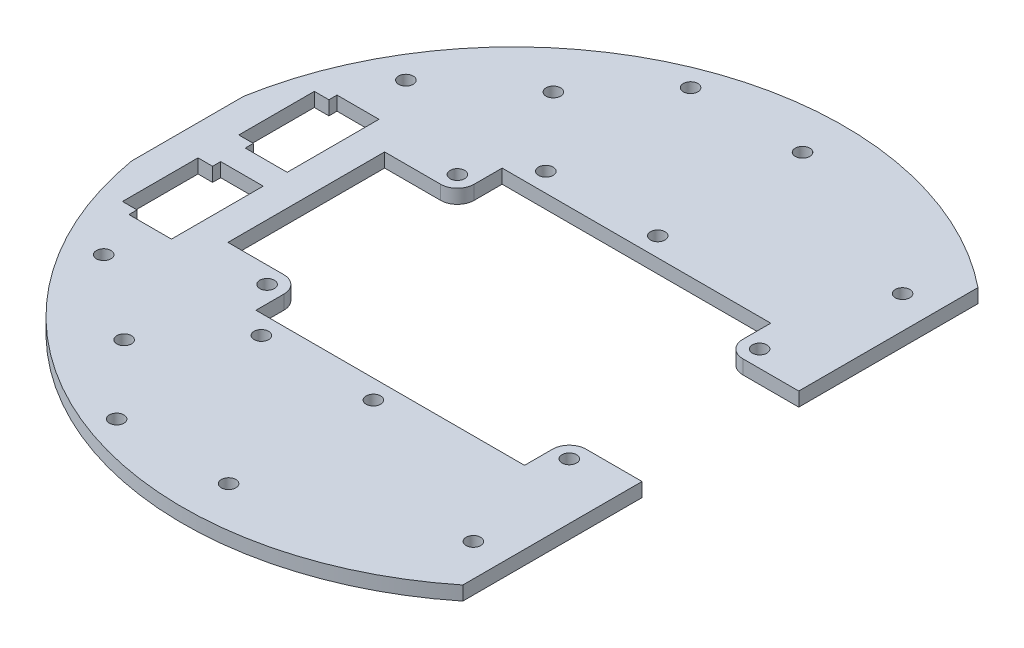
from build123d import *

# Parameters (mm, degrees)
SKETCH1_R           = 1.651
BOSS_EXTRUDE1_DEPTH = 3.175
CUT_EXTRUDE1_START  = -3.175
CUT_EXTRUDE1_DEPTH  = 3.175


with BuildPart() as part:
    # Sketch1 → Boss-Extrude1 (new body)
    with BuildSketch(Plane(origin=(0, 0, 0), x_dir=(1, 0, 0), z_dir=(0, 1, 0))):
        with BuildLine():
            Line((-73.916912814, 12.7), (-73.916912814, -12.7))
            ThreePointArc((-73.916912814, -12.7), (75, 0), (-73.916912814, 12.7))
        make_face()
        with Locations(Location((-34.29, 21.59, 0), (0, 0, 270))):
            Circle(SKETCH1_R, mode=Mode.SUBTRACT)
        with Locations(Location((34.29, 21.59, 0), (0, 0, 270))):
            Circle(SKETCH1_R, mode=Mode.SUBTRACT)
        with Locations(Location((-34.29, -21.59, 0), (0, 0, 270))):
            Circle(SKETCH1_R, mode=Mode.SUBTRACT)
        with Locations(Location((34.29, -21.59, 0), (0, 0, 270))):
            Circle(SKETCH1_R, mode=Mode.SUBTRACT)
        with Locations(Location((39.626912814, -48.698461806, 0), (0, 0, 270))):
            Circle(SKETCH1_R, mode=Mode.SUBTRACT)
        with Locations(Location((-58.676912814, -34.29, 0), (0, 0, 270))):
            Circle(SKETCH1_R, mode=Mode.SUBTRACT)
        with Locations(Location((-58.676912814, 34.29, 0), (0, 0, 270))):
            Circle(SKETCH1_R, mode=Mode.SUBTRACT)
        with Locations(Location((39.626912814, 48.698461806, 0), (0, 0, 270))):
            Circle(SKETCH1_R, mode=Mode.SUBTRACT)
        with Locations(Location((0.498087186, -65.123461806, 0), (0, 0, 90))):
            Circle(SKETCH1_R, mode=Mode.SUBTRACT)
        with Locations(Location((0.498087186, -32.273461806, 0), (0, 0, 90))):
            Circle(SKETCH1_R, mode=Mode.SUBTRACT)
        with Locations(Location((0.498087186, 32.273461806, 0), (0, 0, 270))):
            Circle(SKETCH1_R, mode=Mode.SUBTRACT)
        with Locations(Location((0.498087186, 65.123461806, 0), (0, 0, 270))):
            Circle(SKETCH1_R, mode=Mode.SUBTRACT)
        with Locations(Location((-39.626912814, -48.698461806, 0), (0, 0, 270))):
            Circle(SKETCH1_R, mode=Mode.SUBTRACT)
        with Locations(Location((-24.901912814, -32.273461806, 0), (0, 0, 270))):
            Circle(SKETCH1_R, mode=Mode.SUBTRACT)
        with Locations(Location((-24.901912814, -65.123461806, 0), (0, 0, 270))):
            Circle(SKETCH1_R, mode=Mode.SUBTRACT)
        with Locations(Location((-24.901912814, 65.123461806, 0), (0, 0, 90))):
            Circle(SKETCH1_R, mode=Mode.SUBTRACT)
        with Locations(Location((-39.626912814, 48.698461806, 0), (0, 0, 90))):
            Circle(SKETCH1_R, mode=Mode.SUBTRACT)
        with Locations(Location((-24.901912814, 32.273461806, 0), (0, 0, 90))):
            Circle(SKETCH1_R, mode=Mode.SUBTRACT)
        with BuildLine():
            Line((-30.48, 27.94), (30.48, 27.94))
            Line((30.48, 27.94), (30.48, 21.59))
            ThreePointArc((30.48, 21.59), (31.595923164, 18.895923164), (34.29, 17.78))
            Line((34.29, 17.78), (46.99, 17.78))
            Line((46.99, 17.78), (46.99, -17.78))
            Line((46.99, -17.78), (34.29, -17.78))
            ThreePointArc((34.29, -17.78), (31.595923164, -18.895923164), (30.48, -21.59))
            Line((30.48, -21.59), (30.48, -27.94))
            Line((30.48, -27.94), (-30.48, -27.94))
            Line((-30.48, -27.94), (-30.48, -21.59))
            ThreePointArc((-30.48, -21.59), (-31.595923164, -18.895923164), (-34.29, -17.78))
            Line((-34.29, -17.78), (-46.99, -17.78))
            Line((-46.99, -17.78), (-46.99, 17.78))
            Line((-46.99, 17.78), (-34.29, 17.78))
            ThreePointArc((-34.29, 17.78), (-31.595923164, 18.895923164), (-30.48, 21.59))
            Line((-30.48, 21.59), (-30.48, 27.94))
        make_face(mode=Mode.SUBTRACT)
        Polygon((-66.997078327, -4.560855709), (-63.695078327, -4.560855709), (-63.695078327, -2.72123678), (-54.039956407, -2.72123678), (-54.039956407, -4.558974638), (-54.039956407, -21.70773678), (-54.039956407, -23.545474638), (-63.695078327, -23.545474638), (-63.695078327, -21.705855709), (-66.997078327, -21.705855709), align=None, mode=Mode.SUBTRACT)
        Polygon((-66.866956407, 21.70773678), (-63.564956407, 21.70773678), (-63.564956407, 23.54923678), (-54.039956407, 23.54923678), (-54.039956407, 21.70773678), (-54.039956407, 4.56273678), (-54.039956407, 2.72123678), (-63.564956407, 2.72123678), (-63.564956407, 4.56273678), (-66.866956407, 4.56273678), align=None, mode=Mode.SUBTRACT)
    extrude(amount=BOSS_EXTRUDE1_DEPTH)

    # Sketch2 → Cut-Extrude1 (cut)
    with BuildSketch(Plane(origin=(0, 3.175, 0), x_dir=(1, 0, 0), z_dir=(0, 1, 0)).offset(CUT_EXTRUDE1_START)):
        with BuildLine():
            Line((46.99, 58.454596911), (46.99, -58.454596911))
            ThreePointArc((46.99, -58.454596911), (75, 0), (46.99, 58.454596911))
        make_face()
    extrude(amount=CUT_EXTRUDE1_DEPTH, mode=Mode.SUBTRACT)


solid = part.part
